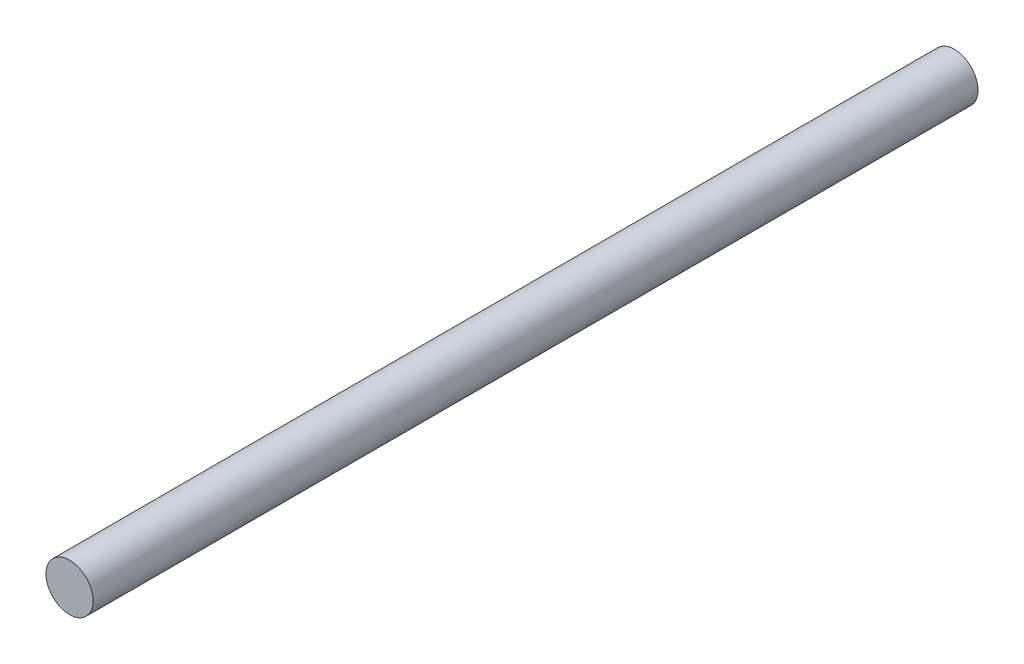
from build123d import *

# Parameters (mm, degrees)
ESQUISSE1_R        = 4
BOSS_EXTRU_1_DEPTH = 150


with BuildPart() as part:
    # Esquisse1 → Boss.-Extru.1 (new body)
    with BuildSketch(Plane.XY):
        Circle(ESQUISSE1_R)
    extrude(amount=BOSS_EXTRU_1_DEPTH)


solid = part.part
